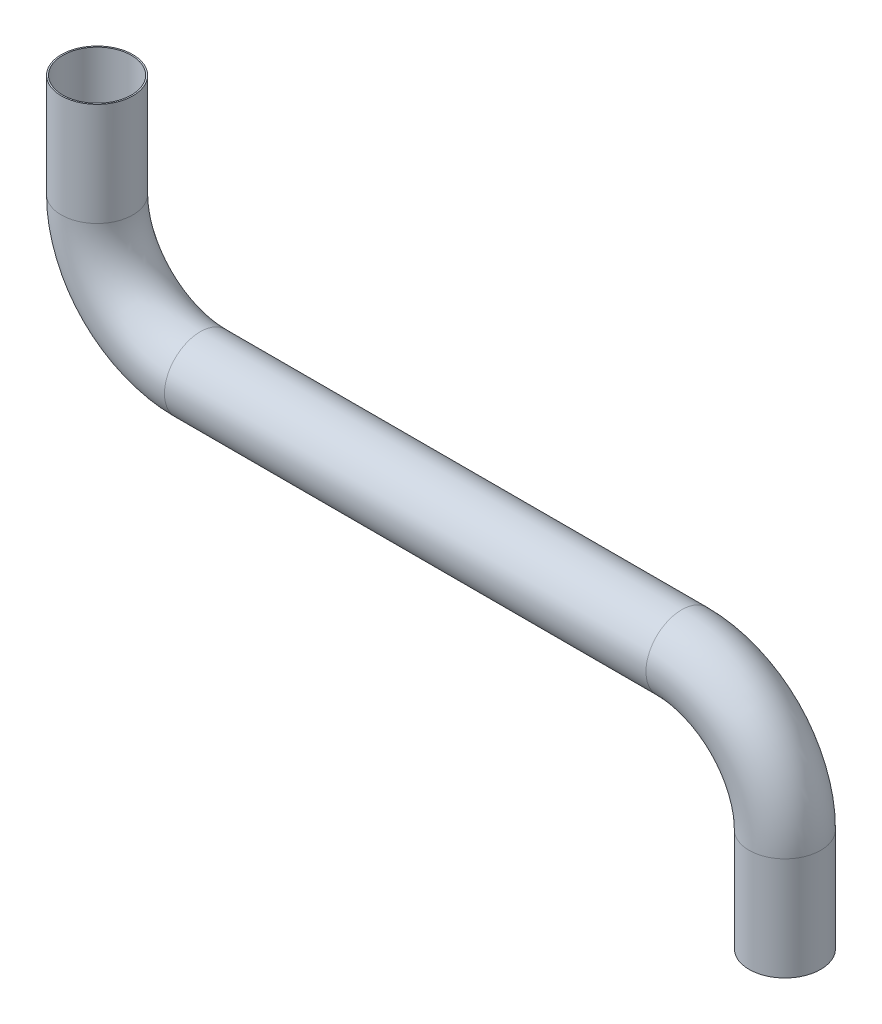
from build123d import *

# Parameters (mm, degrees)
SKETCH1_R   = 26
SKETCH1_R_2 = 25


with BuildPart() as part:
    # Sweep-Thin1: sweep along a path in Sketch2
    with BuildLine(Plane.XY) as sweep_thin1_path:
        Line((0, 0), (0, -75))
        ThreePointArc((0, -75), (21.966991411, -128.033008589), (75, -150))
        Line((75, -150), (425, -150))
        ThreePointArc((425, -150), (478.033008589, -171.966991411), (500, -225))
        Line((500, -225), (500, -300))
    # Sketch1 → Sweep-Thin1 (sweep)
    with BuildSketch(Plane(origin=(0, 0, 0), x_dir=(1, 0, 0), z_dir=(0, 1, 0))):
        Circle(SKETCH1_R)
        Circle(SKETCH1_R_2, mode=Mode.SUBTRACT)
    sweep(path=sweep_thin1_path.line)


solid = part.part
